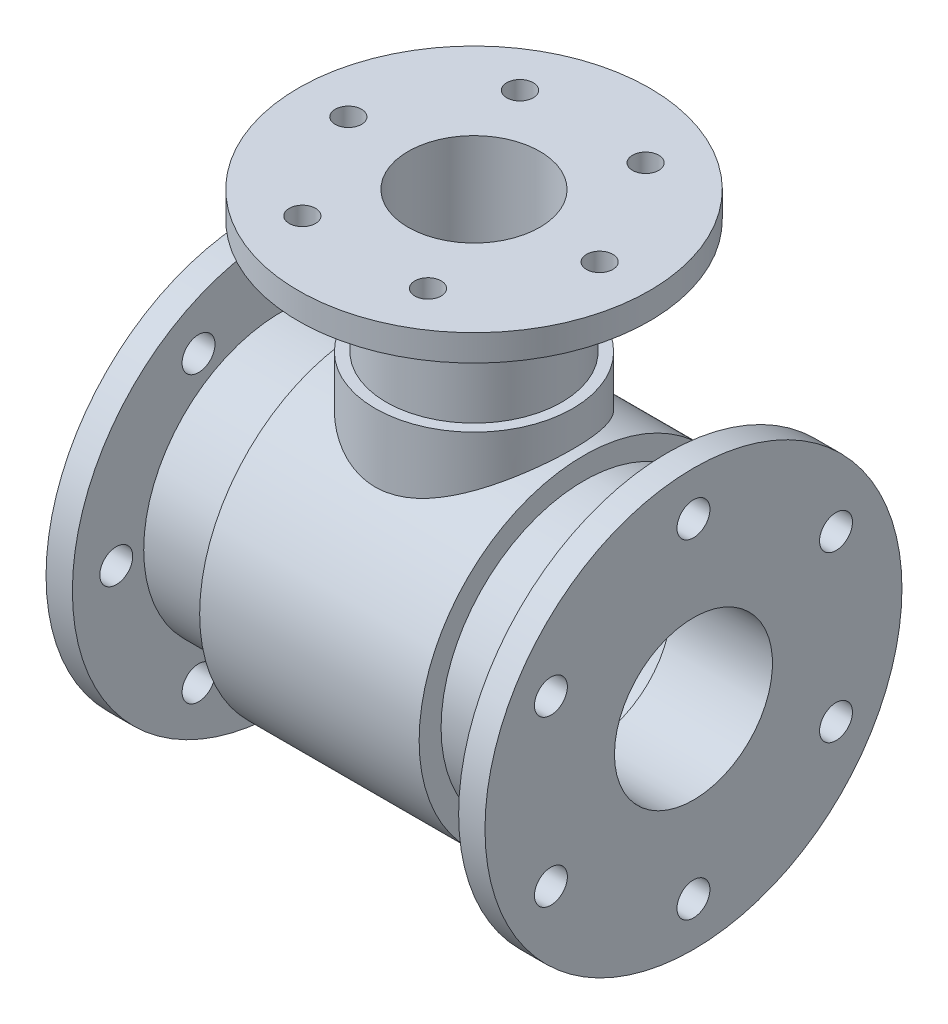
from build123d import *

# Parameters (mm, degrees)
F_10_0MM_DOWEL_HOLE1_D      = 15
F_10_0MM_DOWEL_HOLE1_DEPTH  = 12
CIRPATTERN1_COUNT           = 6
F_10_0MM_DOWEL_HOLE2_D      = 15
F_10_0MM_DOWEL_HOLE2_DEPTH  = 12
CIRPATTERN2_COUNT           = 6
BOSS_EXTRUDE1_REACH         = 220.918
BOSS_EXTRUDE1_END_RADIUS    = 75
SKETCH12_R                  = 45
F_10_0MM_DOWEL_HOLE3_REACH  = 287.526
F_10_0MM_DOWEL_HOLE3_BORE_R = 30
F_12_0MM_DOWEL_HOLE1_D      = 12
F_12_0MM_DOWEL_HOLE1_DEPTH  = 12
CIRPATTERN3_COUNT           = 6


with BuildPart() as part:
    # Sketch1 → Revolve1 (revolve)
    with BuildSketch(Plane.XY, mode=Mode.PRIVATE) as revolve1_sk:
        Polygon((-100, -52.5), (-100, -95), (-88, -95), (-88, -62.5), (-50, -62.5), (-50, -75), (50, -75), (50, -65), (74, -65), (74, -50), (88, -50), (88, -95), (100, -95), (100, -36), (54, -36), (54, -43.5), (37, -43.5), (37, -52.5), (-35, -52.5), (-35, -47.5), (-95, -47.5), (-95, -52.5), align=None)
    revolve(revolve1_sk.sketch.rotate(Axis((0, 0, 0), (1, 0, 0)), 270), axis=Axis((0, 0, 0), (1, 0, 0)))

    # Ø10.0mm Dowel Hole1
    with Locations(Plane(origin=(100, 0, 0), x_dir=(0, 0, -1), z_dir=(1, 0, 0))):
        with Locations((0, 75)):
            f_10_0mm_dowel_hole1 = Hole(F_10_0MM_DOWEL_HOLE1_D / 2, depth=F_10_0MM_DOWEL_HOLE1_DEPTH)

    # CirPattern1: Ø10.0mm Dowel Hole1 ×6 about axis
    cirpattern1_axis = Axis((0, 0, 0), (1, 0, 0))
    for i in range(1, CIRPATTERN1_COUNT):
        add(f_10_0mm_dowel_hole1.rotate(cirpattern1_axis, i * 360 / CIRPATTERN1_COUNT), mode=Mode.SUBTRACT)

    # Ø10.0mm Dowel Hole2
    with Locations(Plane.ZY.offset(100)):
        with Locations((75, 0)):
            f_10_0mm_dowel_hole2 = Hole(F_10_0MM_DOWEL_HOLE2_D / 2, depth=F_10_0MM_DOWEL_HOLE2_DEPTH)

    # CirPattern2: Ø10.0mm Dowel Hole2 ×6 about axis
    cirpattern2_axis = Axis((0, 0, 0), (1, 0, 0))
    for i in range(1, CIRPATTERN2_COUNT):
        add(f_10_0mm_dowel_hole2.rotate(cirpattern2_axis, i * 360 / CIRPATTERN2_COUNT), mode=Mode.SUBTRACT)



with BuildPart() as body_2:
    # Sketch7 → Revolve3 (revolve)
    with BuildSketch(Plane.XY, mode=Mode.PRIVATE) as revolve3_sk:
        Polygon((0, 155), (80, 155), (80, 143), (40, 143), (40, 91), (45, 91), (45, 75), (0, 75), align=None)
    revolve(revolve3_sk.sketch.rotate(Axis((0, 0, 0), (0, 1, 0)), 90), axis=Axis((0, 0, 0), (0, 1, 0)))


with BuildPart() as part_1:
    add(part.part)

    add(body_2.part)  # Boss-Extrude1 merges body 2
    # Boss-Extrude1: up to this cylinder (the profile starts outside it)
    boss_extrude1_end = Plane(origin=(0, 0, 0), z_dir=(-1, 0, 0)) * Cylinder(BOSS_EXTRUDE1_END_RADIUS, 592.836, mode=Mode.PRIVATE)
    # Sketch12 → Boss-Extrude1 (add, up to the surface)
    with BuildSketch(Plane.XZ.offset(-75), mode=Mode.PRIVATE) as boss_extrude1_sk1:
        with Locations(Location((0, 0, 0), (0, 0, 90))):
            Circle(SKETCH12_R)
    boss_extrude1_tool1 = extrude(boss_extrude1_sk1.sketch, amount=BOSS_EXTRUDE1_REACH, mode=Mode.PRIVATE) - boss_extrude1_end
    add(boss_extrude1_tool1.solids().sort_by_distance((0, 75, 0))[0])
    add(boss_extrude1_tool1.solids().sort_by_distance((0, 75, 0))[1])

    # Ø10.0mm Dowel Hole3 bore → Ø10.0mm Dowel Hole3 (cut, up to next)
    with BuildSketch(Plane(origin=(0, 155, 0), x_dir=(1, 0, 0), z_dir=(0, 1, 0)), mode=Mode.PRIVATE) as f_10_0mm_dowel_hole3_sk1:
        Circle(F_10_0MM_DOWEL_HOLE3_BORE_R)
    f_10_0mm_dowel_hole3_tool1 = extrude(f_10_0mm_dowel_hole3_sk1.sketch, amount=-F_10_0MM_DOWEL_HOLE3_REACH, mode=Mode.PRIVATE) & part_1.part
    add(f_10_0mm_dowel_hole3_tool1.solids().sort_by_distance((0, 155, 0))[0], mode=Mode.SUBTRACT)

    # Ø12.0mm Dowel Hole1
    with Locations(Plane(origin=(-57.25292317, 155, 0), x_dir=(0, 0, 1), z_dir=(0, 1, 0))):
        with Locations((0, 0)):
            f_12_0mm_dowel_hole1 = Hole(F_12_0MM_DOWEL_HOLE1_D / 2, depth=F_12_0MM_DOWEL_HOLE1_DEPTH)

    # CirPattern3: Ø12.0mm Dowel Hole1 ×6 about axis
    cirpattern3_axis = Axis((0, 0, 0), (0, 1, 0))
    for i in range(1, CIRPATTERN3_COUNT):
        add(f_12_0mm_dowel_hole1.rotate(cirpattern3_axis, i * 360 / CIRPATTERN3_COUNT), mode=Mode.SUBTRACT)


solid = part_1.part
